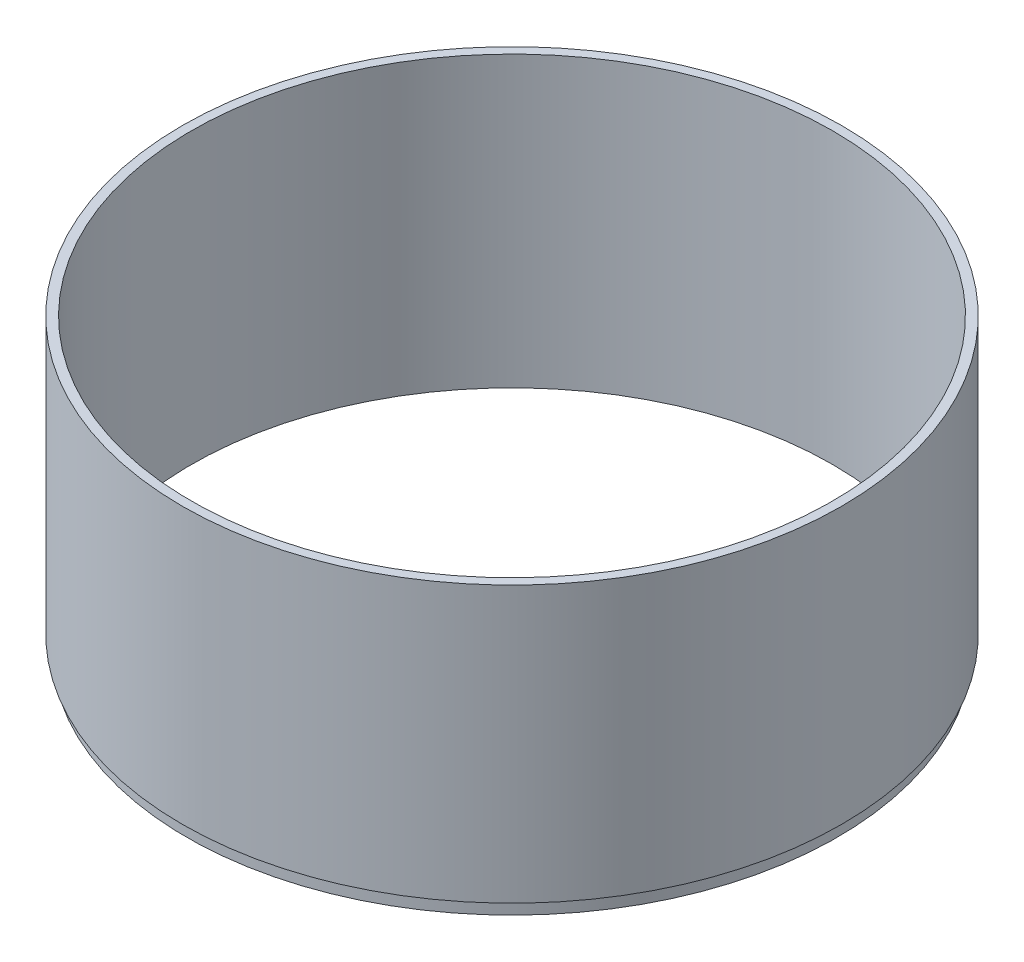
from build123d import *


with BuildPart() as part:
    # Schizzo1 → Rivoluzione1 (revolve)
    with BuildSketch(Plane.XY, mode=Mode.PRIVATE) as rivoluzione1_sk:
        Polygon((-71, 3), (-71, 0), (-72, 0), (-72, 3), (-73, 3), (-73, 64), (-71, 64), align=None)
    revolve(rivoluzione1_sk.sketch.rotate(Axis((0, 0, 0), (0, 1, 0)), 270), axis=Axis((0, 0, 0), (0, 1, 0)))


solid = part.part
